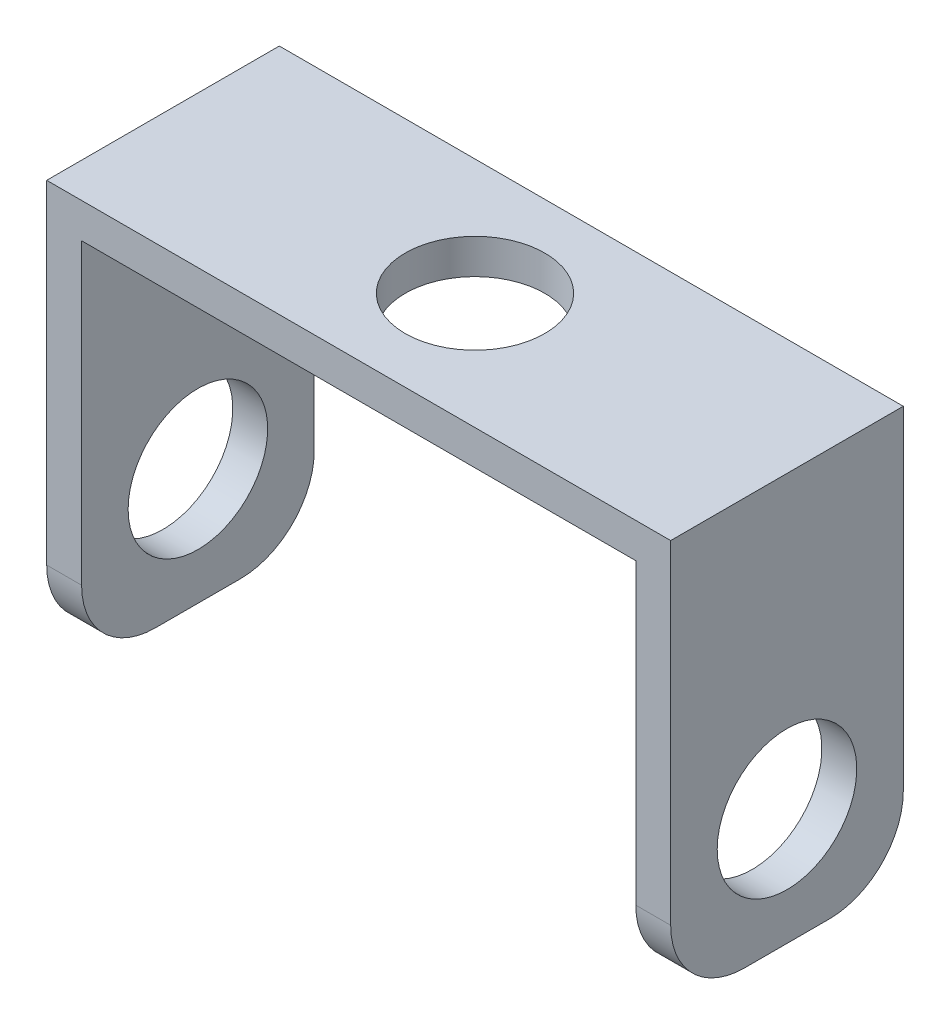
from build123d import *

# Parameters (mm, degrees)
SKETCH2_W           = 47.65
SKETCH2_H           = 20
SKETCH2_R           = 6
BOSS_EXTRUDE1_DEPTH = 3
SKETCH3_W           = 20
SKETCH3_H           = 35
BOSS_EXTRUDE3_DEPTH = 3
SKETCH4_W           = 20
SKETCH4_H           = 35
BOSS_EXTRUDE4_DEPTH = 3
CUT_EXTRUDE1_REACH  = 67.592
SKETCH5_R           = 6
FILLET1_R           = 6.35


with BuildPart() as part:
    # Sketch2 → Boss-Extrude1 (new body)
    with BuildSketch(Plane(origin=(0, 0, 0), x_dir=(1, 0, 0), z_dir=(0, 1, 0))):
        with Locations((23.825, -10)):
            Rectangle(SKETCH2_W, SKETCH2_H)
        with Locations(Location((23.825, -10, 0), (0, 0, 270))):
            Circle(SKETCH2_R, mode=Mode.SUBTRACT)
    extrude(amount=BOSS_EXTRUDE1_DEPTH)

    # Sketch3 → Boss-Extrude3 (add)
    with BuildSketch(Plane(origin=(47.65, 0, 0), x_dir=(0, 0, -1), z_dir=(1, 0, 0))):
        with Locations((-10, -14.5)):
            Rectangle(SKETCH3_W, SKETCH3_H)
    extrude(amount=BOSS_EXTRUDE3_DEPTH)

    # Sketch4 → Boss-Extrude4 (add)
    with BuildSketch(Plane.ZY):
        with Locations((10, -14.5)):
            Rectangle(SKETCH4_W, SKETCH4_H)
    extrude(amount=BOSS_EXTRUDE4_DEPTH)

    # Cut-Extrude1: up to this face of the body (flat: up to its plane)
    cut_extrude1_end = Plane(part.part.faces().sort_by_distance((50.65, -14.5, 10))[0])
    # Sketch5 → Cut-Extrude1 (cut, up to the picked face)
    with BuildSketch(Plane.ZY.offset(3), mode=Mode.PRIVATE) as cut_extrude1_sk1:
        with Locations((10, -22)):
            Circle(SKETCH5_R)
    cut_extrude1_tool1 = split(extrude(cut_extrude1_sk1.sketch, amount=-CUT_EXTRUDE1_REACH, mode=Mode.PRIVATE), bisect_by=cut_extrude1_end, keep=Keep.BOTH, mode=Mode.PRIVATE)
    add(cut_extrude1_tool1.solids().sort_by(Axis((-3, -22, 10), (1, 0, 0)))[0], mode=Mode.SUBTRACT)

    # Fillet1
    fillet1_edges = [part.edges().sort_by_distance(p)[0] for p in [
        (49.15, -32, 20),
        (49.15, -32, 0),
        (-1.5, -32, 0),
        (-1.5, -32, 20),
    ]]
    fillet(fillet1_edges, radius=FILLET1_R)


solid = part.part
